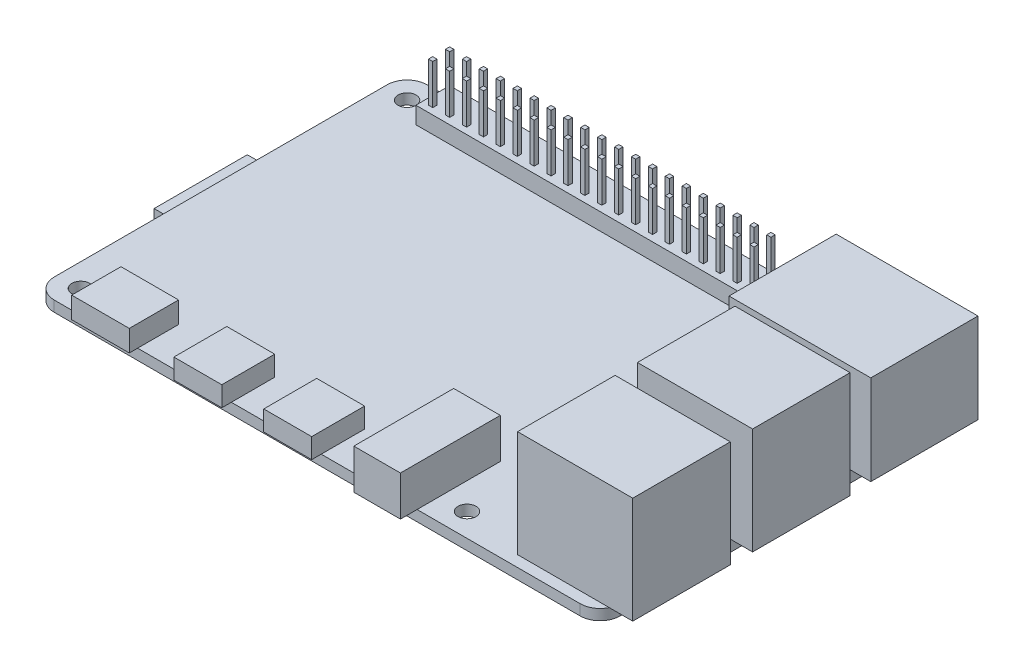
from build123d import *

# Parameters (mm, degrees)
SKETCH1_W             = 85
SKETCH1_H             = 56
SKETCH1_R             = 1.35
PCB_DEPTH             = 1.6
PCB_CORNERS_R         = 3
CONNECTORS_W          = 21.3
CONNECTORS_H          = 16.1
ETHERNET_DEPTH        = 13.5
SKETCH2_4_W           = 17.3
SKETCH2_4_H           = 14.65
USB_PORTS_DEPTH       = 16
SKETCH2_5_W           = 8.65
SKETCH2_5_H           = 7.4
USB_C_DEPTH           = 3.2
CONNECTORS_6_W        = 7.2
CONNECTORS_6_H        = 7.95
MICRO_USB_DEPTH       = 3
CONNECTORS_7_W        = 7
CONNECTORS_7_H        = 15
AUDIO_JACK_DEPTH      = 6
CONNECTORS_8_W        = 50.3
CONNECTORS_8_H        = 5.08
PIN_HEADER_DEPTH      = 2.54
SKETCH6_W             = 0.64
SKETCH6_H             = 0.64
PIN_HEADER_PINS_DEPTH = 6
SKETCH7_W             = 17
SKETCH7_H             = 14
BOSS_EXTRUDE1_DEPTH   = 2


with BuildPart() as part:
    # Sketch1 → PCB (new body)
    with BuildSketch(Plane(origin=(0, 0, 0), x_dir=(1, 0, 0), z_dir=(0, 1, 0))):
        Rectangle(SKETCH1_W, SKETCH1_H)
        with Locations((-39, 24.5)):
            Circle(SKETCH1_R, mode=Mode.SUBTRACT)
        with Locations((19, 24.5)):
            Circle(SKETCH1_R, mode=Mode.SUBTRACT)
        with Locations((19, -24.5)):
            Circle(SKETCH1_R, mode=Mode.SUBTRACT)
        with Locations((-39, -24.5)):
            Circle(SKETCH1_R, mode=Mode.SUBTRACT)
    extrude(amount=PCB_DEPTH)

    # PCB Corners
    pcb_corners_edges = [part.edges().sort_by_distance(p)[0] for p in [
        (-42.5, 0.8, -28),
        (42.5, 0.8, -28),
        (42.5, 0.8, 28),
        (-42.5, 0.8, 28),
    ]]
    fillet(pcb_corners_edges, radius=PCB_CORNERS_R)

    # Connectors → Ethernet (add)
    with BuildSketch(Plane(origin=(0, 1.6, 0), x_dir=(1, 0, 0), z_dir=(0, 1, 0))):
        with Locations((34.8, 17.75)):
            Rectangle(CONNECTORS_W, CONNECTORS_H)
    extrude(amount=ETHERNET_DEPTH)

    # Sketch2<4> → USB Ports (add)
    with BuildSketch(Plane(origin=(0, 1.6, 0), x_dir=(1, 0, 0), z_dir=(0, 1, 0))):
        with Locations((37.069, -19)):
            Rectangle(SKETCH2_4_W, SKETCH2_4_H)
        with Locations((37.069, -1)):
            Rectangle(SKETCH2_4_W, SKETCH2_4_H)
    extrude(amount=USB_PORTS_DEPTH)

    # Sketch2<5> → USB C (add)
    with BuildSketch(Plane(origin=(0, 1.6, 0), x_dir=(1, 0, 0), z_dir=(0, 1, 0))):
        with Locations((-31.3, -25.55)):
            Rectangle(SKETCH2_5_W, SKETCH2_5_H)
    extrude(amount=USB_C_DEPTH)

    # Connectors<6> → Micro USB (add)
    with BuildSketch(Plane(origin=(0, 1.6, 0), x_dir=(1, 0, 0), z_dir=(0, 1, 0))):
        with Locations((-3, -25.455)):
            Rectangle(CONNECTORS_6_W, CONNECTORS_6_H)
        with Locations((-16.5, -25.455)):
            Rectangle(CONNECTORS_6_W, CONNECTORS_6_H)
    extrude(amount=MICRO_USB_DEPTH)

    # Connectors<7> → Audio Jack (add)
    with BuildSketch(Plane(origin=(0, 1.6, 0), x_dir=(1, 0, 0), z_dir=(0, 1, 0))):
        with Locations((11.5, -23)):
            Rectangle(CONNECTORS_7_W, CONNECTORS_7_H)
    extrude(amount=AUDIO_JACK_DEPTH)

    # Connectors<8> → Pin Header (add)
    with BuildSketch(Plane(origin=(0, 1.6, 0), x_dir=(1, 0, 0), z_dir=(0, 1, 0))):
        with Locations((-10, 24.5)):
            Rectangle(CONNECTORS_8_W, CONNECTORS_8_H)
    extrude(amount=PIN_HEADER_DEPTH)

    # Sketch6 → Pin Header Pins (add)
    with BuildSketch(Plane(origin=(0, 4.14, 0), x_dir=(1, 0, 0), z_dir=(0, 1, 0))):
        with Locations((-33.88, 25.77)):
            Rectangle(SKETCH6_W, SKETCH6_H)
        with Locations((-31.34, 25.77)):
            Rectangle(SKETCH6_W, SKETCH6_H)
        with Locations((-28.8, 25.77)):
            Rectangle(SKETCH6_W, SKETCH6_H)
        with Locations((-26.26, 25.77)):
            Rectangle(SKETCH6_W, SKETCH6_H)
        with Locations((-23.72, 25.77)):
            Rectangle(SKETCH6_W, SKETCH6_H)
        with Locations((-21.18, 25.77)):
            Rectangle(SKETCH6_W, SKETCH6_H)
        with Locations((-18.64, 25.77)):
            Rectangle(SKETCH6_W, SKETCH6_H)
        with Locations((-16.1, 25.77)):
            Rectangle(SKETCH6_W, SKETCH6_H)
        with Locations((-13.56, 25.77)):
            Rectangle(SKETCH6_W, SKETCH6_H)
        with Locations((-11.02, 25.77)):
            Rectangle(SKETCH6_W, SKETCH6_H)
        with Locations((-8.48, 25.77)):
            Rectangle(SKETCH6_W, SKETCH6_H)
        with Locations((-5.94, 25.77)):
            Rectangle(SKETCH6_W, SKETCH6_H)
        with Locations((-3.4, 25.77)):
            Rectangle(SKETCH6_W, SKETCH6_H)
        with Locations((-0.86, 25.77)):
            Rectangle(SKETCH6_W, SKETCH6_H)
        with Locations((1.68, 25.77)):
            Rectangle(SKETCH6_W, SKETCH6_H)
        with Locations((4.22, 25.77)):
            Rectangle(SKETCH6_W, SKETCH6_H)
        with Locations((6.76, 25.77)):
            Rectangle(SKETCH6_W, SKETCH6_H)
        with Locations((9.3, 25.77)):
            Rectangle(SKETCH6_W, SKETCH6_H)
        with Locations((11.84, 25.77)):
            Rectangle(SKETCH6_W, SKETCH6_H)
        with Locations((14.38, 25.77)):
            Rectangle(SKETCH6_W, SKETCH6_H)
        with Locations((-31.34, 23.23)):
            Rectangle(SKETCH6_W, SKETCH6_H)
        with Locations((-28.8, 23.23)):
            Rectangle(SKETCH6_W, SKETCH6_H)
        with Locations((-26.26, 23.23)):
            Rectangle(SKETCH6_W, SKETCH6_H)
        with Locations((-23.72, 23.23)):
            Rectangle(SKETCH6_W, SKETCH6_H)
        with Locations((-21.18, 23.23)):
            Rectangle(SKETCH6_W, SKETCH6_H)
        with Locations((-18.64, 23.23)):
            Rectangle(SKETCH6_W, SKETCH6_H)
        with Locations((-16.1, 23.23)):
            Rectangle(SKETCH6_W, SKETCH6_H)
        with Locations((-13.56, 23.23)):
            Rectangle(SKETCH6_W, SKETCH6_H)
        with Locations((-11.02, 23.23)):
            Rectangle(SKETCH6_W, SKETCH6_H)
        with Locations((-8.48, 23.23)):
            Rectangle(SKETCH6_W, SKETCH6_H)
        with Locations((-5.94, 23.23)):
            Rectangle(SKETCH6_W, SKETCH6_H)
        with Locations((-3.4, 23.23)):
            Rectangle(SKETCH6_W, SKETCH6_H)
        with Locations((-0.86, 23.23)):
            Rectangle(SKETCH6_W, SKETCH6_H)
        with Locations((1.68, 23.23)):
            Rectangle(SKETCH6_W, SKETCH6_H)
        with Locations((4.22, 23.23)):
            Rectangle(SKETCH6_W, SKETCH6_H)
        with Locations((6.76, 23.23)):
            Rectangle(SKETCH6_W, SKETCH6_H)
        with Locations((9.3, 23.23)):
            Rectangle(SKETCH6_W, SKETCH6_H)
        with Locations((11.84, 23.23)):
            Rectangle(SKETCH6_W, SKETCH6_H)
        with Locations((14.38, 23.23)):
            Rectangle(SKETCH6_W, SKETCH6_H)
        with Locations((-33.88, 23.23)):
            Rectangle(SKETCH6_W, SKETCH6_H)
    extrude(amount=PIN_HEADER_PINS_DEPTH)

    # Sketch7 → Boss-Extrude1 (add)
    with BuildSketch(Plane.XZ):
        with Locations((-37, 0)):
            Rectangle(SKETCH7_W, SKETCH7_H)
    extrude(amount=BOSS_EXTRUDE1_DEPTH)


solid = part.part
